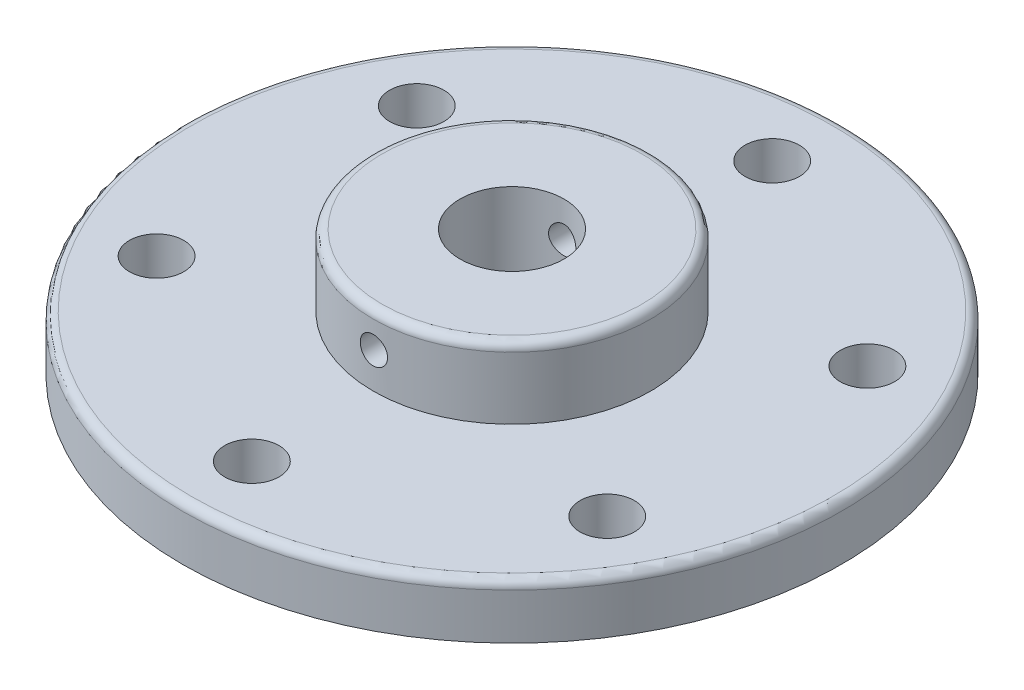
from build123d import *

# Parameters (mm, degrees)
SKETCH1_R                   = 30.1625
SKETCH1_R_2                 = 12.7
SKETCH1_R_3                 = 4.7625
BOSS_EXTRUDE1_DEPTH         = 5
BOSS_EXTRUDE2_START         = 6.5
SKETCH1_3_R                 = 12.7
SKETCH1_3_R_2               = 4.7625
BOSS_EXTRUDE2_DEPTH         = 6.5
F_10_CLEARANCE_HOLE1_D      = 4.9784
TAP_DRILL_FOR_M3X0_5_TAP1_D = 2.5
FILLET1_R                   = 0.79375


with BuildPart() as part:
    # Sketch1 → Boss-Extrude1 (new body)
    # profile 1 of 2: a face of its own
    with BuildSketch(Plane(origin=(0, 0, 0), x_dir=(1, 0, 0), z_dir=(0, 1, 0))):
        with Locations(Location((0, 0, 0), (0, 0, 270))):
            Circle(SKETCH1_R)
        Circle(SKETCH1_R_2, mode=Mode.SUBTRACT)
    # profile 2 of 2: a face of its own
    with BuildSketch(Plane(origin=(0, 0, 0), x_dir=(1, 0, 0), z_dir=(0, 1, 0))):
        Circle(SKETCH1_R_2)
        with Locations(Location((0, 0, 0), (0, 0, 270))):
            Circle(SKETCH1_R_3, mode=Mode.SUBTRACT)
    extrude(amount=-BOSS_EXTRUDE1_DEPTH)

    # Sketch1<3> → Boss-Extrude2 (add)
    with BuildSketch(Plane(origin=(0, 0, 0), x_dir=(1, 0, 0), z_dir=(0, 1, 0)).offset(BOSS_EXTRUDE2_START)):
        with Locations(Location((0, 0, 0), (0, 0, 90))):
            Circle(SKETCH1_3_R)
        with Locations(Location((0, 0, 0), (0, 0, 270))):
            Circle(SKETCH1_3_R_2, mode=Mode.SUBTRACT)
    extrude(amount=-BOSS_EXTRUDE2_DEPTH)

    # #10 Clearance Hole1 (through all)
    with Locations(Plane(origin=(0, 0, -23.8125), x_dir=(0, 0, 1), z_dir=(0, 1, 0))):
        with Locations((0, 0), (11.90625, 20.622229928), (35.71875, 20.622229928), (11.90625, -20.622229928), (35.71875, -20.622229928), (47.625, 0)):
            Hole(F_10_CLEARANCE_HOLE1_D / 2)

    # Tap Drill for M3x0.5 Tap1 (through all)
    with Locations(Plane(origin=(0, 3.25, 12.7), x_dir=(1, 0, 0), z_dir=(0, 0, 1))):
        with Locations((0, 0)):
            Hole(TAP_DRILL_FOR_M3X0_5_TAP1_D / 2)

    # Fillet1
    fillet1_edges = [part.edges().sort_by_distance(p)[0] for p in [
        (0, 6.5, 12.7),
        (0, 0, -30.1625),
    ]]
    fillet(fillet1_edges, radius=FILLET1_R)


solid = part.part
